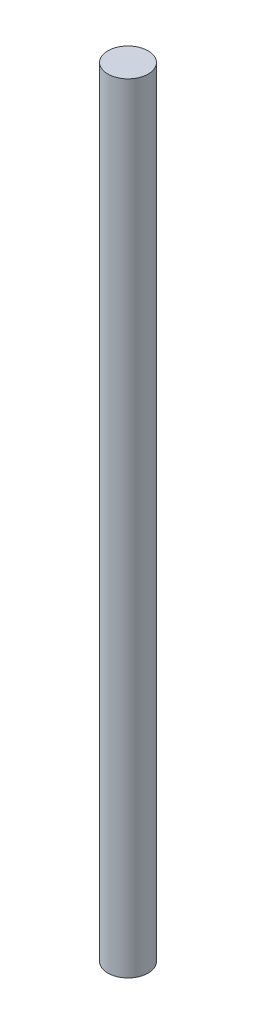
from build123d import *

# Parameters (mm, degrees)
SKETCH2_R           = 22.5
BOSS_EXTRUDE1_DEPTH = 870


with BuildPart() as part:
    # Sketch2 → Boss-Extrude1 (new body)
    with BuildSketch(Plane(origin=(0, 0, 0), x_dir=(1, 0, 0), z_dir=(0, 1, 0))):
        with Locations(Location((0, 0, 0), (0, 0, 90))):
            Circle(SKETCH2_R)
    extrude(amount=BOSS_EXTRUDE1_DEPTH)


solid = part.part
